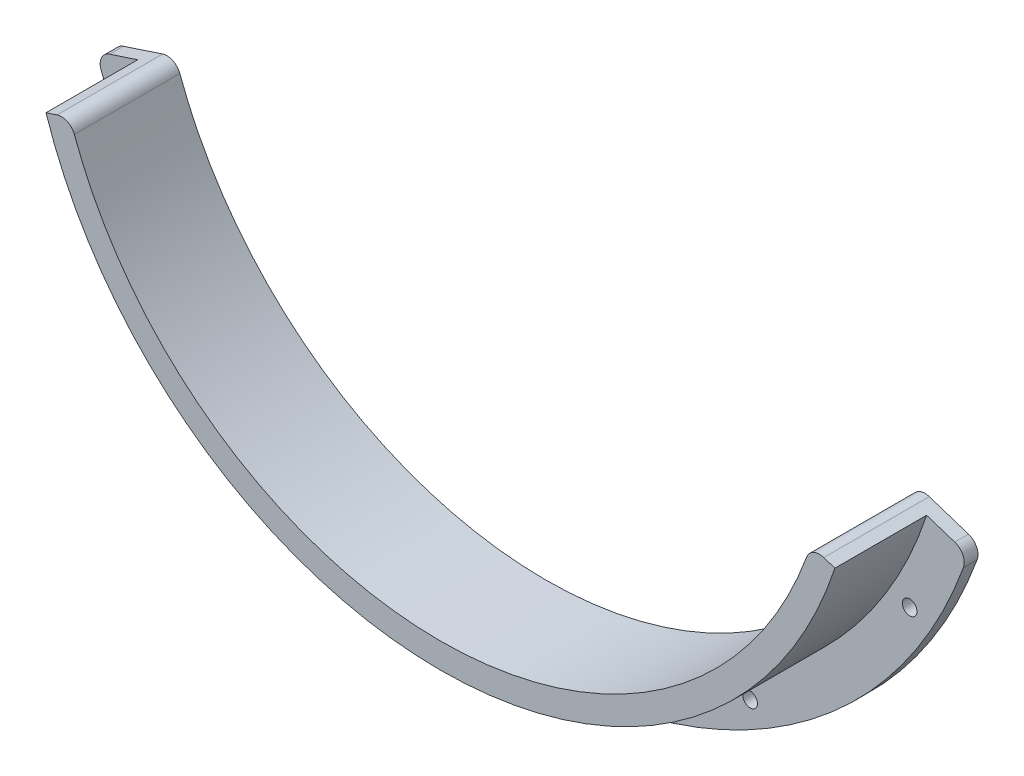
from build123d import *

# Parameters (mm, degrees)
SKETCH_1_R      = 1.6
EXTRUDE_1_DEPTH = 3
EXTRUDE_2_DEPTH = 20
FILLET_1_R      = 3


with BuildPart() as part:
    # 草图1 → 凸台-拉伸1 (new body)
    with BuildSketch(Plane.XY):
        with BuildLine():
            ThreePointArc((80.75, -26.541241493), (0, -85), (-80.75, -26.541241493))
            Line((-80.75, -26.541241493), (-95, -31.224989992))
            ThreePointArc((-95, -31.224989992), (0, -100), (95, -31.224989992))
            Line((95, -31.224989992), (80.75, -26.541241493))
        make_face()
        with Locations((-47.5, -82.27241336)):
            Circle(SKETCH_1_R, mode=Mode.SUBTRACT)
        with Locations((-82.27241336, -47.5)):
            Circle(SKETCH_1_R, mode=Mode.SUBTRACT)
        with Locations((0, -95)):
            Circle(SKETCH_1_R, mode=Mode.SUBTRACT)
        with Locations((47.5, -82.27241336)):
            Circle(SKETCH_1_R, mode=Mode.SUBTRACT)
        with Locations((82.27241336, -47.5)):
            Circle(SKETCH_1_R, mode=Mode.SUBTRACT)
    extrude(amount=EXTRUDE_1_DEPTH)

    # 草图2 → 凸台-拉伸2 (add)
    with BuildSketch(Plane.XY.offset(3)):
        with BuildLine():
            ThreePointArc((80.75, -26.541241493), (0, -85), (-80.75, -26.541241493))
            Line((-80.75, -26.541241493), (-85.975, -28.258615943))
            ThreePointArc((-85.975, -28.258615943), (0, -90.5), (85.975, -28.258615943))
            Line((85.975, -28.258615943), (80.75, -26.541241493))
        make_face()
    extrude(amount=EXTRUDE_2_DEPTH)

    # 圆角1
    fillet_1_edges = [part.edges().sort_by_distance(p)[0] for p in [
        (80.75, -26.541241493, 11.5),
        (95, -31.224989992, 1.5),
        (-95, -31.224989992, 1.5),
        (-80.75, -26.541241493, 11.5),
    ]]
    fillet(fillet_1_edges, radius=FILLET_1_R)


solid = part.part
